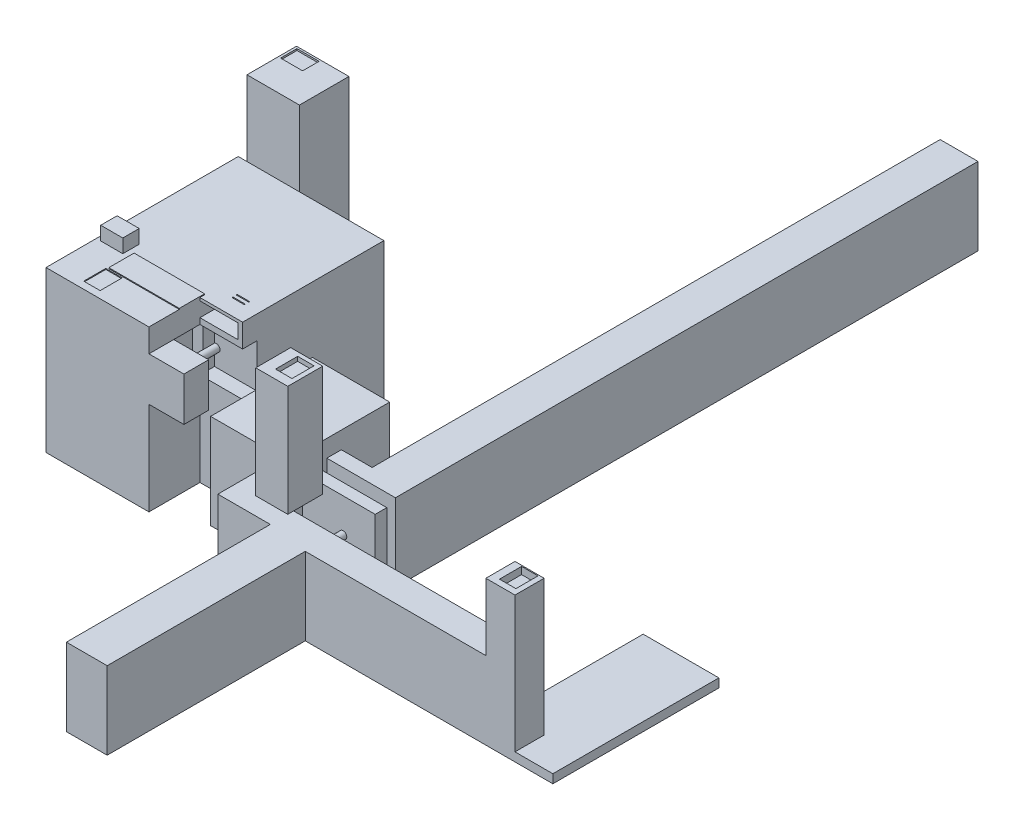
from build123d import *

# Parameters (mm, degrees)
SKETCH1_W            = 500
SKETCH1_H            = 500
BOSS_EXTRUDE1_DEPTH  = 550
SKETCH2_W            = 75.8
SKETCH2_H            = 56.4
BOSS_EXTRUDE2_DEPTH  = 46.8
SKETCH5_W            = 31
SKETCH5_H            = 3.15
BOSS_EXTRUDE4_DEPTH  = 242
SKETCH6_W            = 146.6
SKETCH6_H            = 15
CUT_EXTRUDE2_DEPTH   = 654.834841531
SKETCH7_W            = 353.4
SKETCH7_H            = 550
BOSS_EXTRUDE5_DEPTH  = 160
SKETCH8_W            = 242
SKETCH8_H            = 3.15
BOSS_EXTRUDE6_DEPTH  = 55.8
SKETCH9_W            = 56.4
SKETCH9_H            = 75.8
CUT_EXTRUDE3_DEPTH   = 3.25
CUT_EXTRUDE6_DEPTH   = 10
SKETCH13_W           = 130
SKETCH13_H           = 50
CUT_EXTRUDE7_DEPTH   = 130
LPATTERN1_COUNT      = 2
LPATTERN1_PITCH      = 15
SKETCH14_W           = 146.6
SKETCH14_H           = 150
CUT_EXTRUDE8_DEPTH   = 50
SKETCH15_W           = 350
SKETCH15_H           = 325
BOSS_EXTRUDE7_DEPTH  = 265
SKETCH16_W           = 50
SKETCH16_H           = 266.2
BOSS_EXTRUDE8_DEPTH  = 235.5
SKETCH17_W           = 130
SKETCH17_H           = 266.2
BOSS_EXTRUDE9_DEPTH  = 1950
SKETCH18_W           = 80
SKETCH18_H           = 266.2
BOSS_EXTRUDE10_DEPTH = 160
SKETCH19_W           = 780
SKETCH19_H           = 266.2
BOSS_EXTRUDE11_DEPTH = 240
SKETCH20_W           = 700
SKETCH20_H           = 266.2
CUT_EXTRUDE9_DEPTH   = 100
SKETCH21_W           = 100
SKETCH21_H           = 266.2
BOSS_EXTRUDE12_DEPTH = 720
SKETCH22_W           = 100
SKETCH22_H           = 100
BOSS_EXTRUDE14_DEPTH = 230
SKETCH23_W           = 56.4
SKETCH23_H           = 75.8
CUT_EXTRUDE10_DEPTH  = 24.4
SKETCH24_W           = 40
SKETCH24_H           = 266.2
BOSS_EXTRUDE15_DEPTH = 250
BOSS_EXTRUDE16_REACH = 2623.994
SKETCH25_R           = 12.5
SKETCH26_W           = 110
SKETCH26_H           = 120
BOSS_EXTRUDE22_DEPTH = 365.6
SKETCH28_W           = 110
SKETCH28_H           = 120
SKETCH28_W_2         = 56.4
SKETCH28_H_2         = 75.8
BOSS_EXTRUDE23_DEPTH = 15
SKETCH29_W           = 100
SKETCH29_H           = 150
CUT_EXTRUDE11_DEPTH  = 35
SKETCH30_W           = 85
SKETCH30_H           = 150
BOSS_EXTRUDE24_DEPTH = 120
BOSS_EXTRUDE25_REACH = 2659.625
SKETCH31_R           = 12.5
SKETCH32_W           = 220
SKETCH32_H           = 550
BOSS_EXTRUDE26_DEPTH = 30
SKETCH34_W           = 180
SKETCH34_H           = 808
BOSS_EXTRUDE28_DEPTH = 170
SKETCH35_W           = 75.8
SKETCH35_H           = 56.4
CUT_EXTRUDE12_DEPTH  = 5.8
BOSS_EXTRUDE29_DEPTH = 30


with BuildPart() as part:
    # Sketch1 → Boss-Extrude1 (new body)
    with BuildSketch(Plane(origin=(0, 0, 0), x_dir=(1, 0, 0), z_dir=(0, 1, 0))):
        Rectangle(SKETCH1_W, SKETCH1_H)
    extrude(amount=BOSS_EXTRUDE1_DEPTH)

    # Sketch2 → Boss-Extrude2 (add)
    with BuildSketch(Plane(origin=(0, 550, 0), x_dir=(1, 0, 0), z_dir=(0, 1, 0))):
        with Locations((-197.1, -209)):
            Rectangle(SKETCH2_W, SKETCH2_H)
    extrude(amount=BOSS_EXTRUDE2_DEPTH)

    # Sketch5 → Boss-Extrude4 (add)
    with BuildSketch(Plane(origin=(-138.6, 0, 0), x_dir=(0, 0, -1), z_dir=(1, 0, 0))):
        with Locations((-234.5, 551.575)):
            Rectangle(SKETCH5_W, SKETCH5_H)
    extrude(amount=BOSS_EXTRUDE4_DEPTH)

    # Sketch6 → Cut-Extrude2 (cut, through all)
    with BuildSketch(Plane(origin=(0, 550, 0), x_dir=(1, 0, 0), z_dir=(0, 1, 0))):
        with Locations((176.7, -242.5)):
            Rectangle(SKETCH6_W, SKETCH6_H)
    extrude(amount=-CUT_EXTRUDE2_DEPTH, mode=Mode.SUBTRACT)

    # Sketch7 → Boss-Extrude5 (add)
    with BuildSketch(Plane.XY.offset(250)):
        with Locations((-73.3, 275)):
            Rectangle(SKETCH7_W, SKETCH7_H)
    extrude(amount=BOSS_EXTRUDE5_DEPTH)

    # Sketch8 → Boss-Extrude6 (add)
    with BuildSketch(Plane.XY.offset(250)):
        with Locations((-17.6, 551.575)):
            Rectangle(SKETCH8_W, SKETCH8_H)
    extrude(amount=BOSS_EXTRUDE6_DEPTH)

    # Sketch9 → Cut-Extrude3 (cut)
    with BuildSketch(Plane(origin=(0, 550, 0), x_dir=(1, 0, 0), z_dir=(0, 1, 0))):
        with Locations((-116.6, -347.9)):
            Rectangle(SKETCH9_W, SKETCH9_H)
    extrude(amount=-CUT_EXTRUDE3_DEPTH, mode=Mode.SUBTRACT)

    # Sketch12 → Cut-Extrude6 (cut)
    with BuildSketch(Plane(origin=(0, 550, 0), x_dir=(1, 0, 0), z_dir=(0, 1, 0))):
        with BuildLine():
            Line((200, -176.7), (160, -176.7))
            ThreePointArc((160, -176.7), (158.3, -178.4), (160, -180.1))
            Line((160, -180.1), (200, -180.1))
            ThreePointArc((200, -180.1), (201.7, -178.4), (200, -176.7))
        make_face()
    cut_extrude6 = extrude(amount=-CUT_EXTRUDE6_DEPTH, mode=Mode.SUBTRACT)

    # Sketch13 → Cut-Extrude7 (cut)
    with BuildSketch(Plane.XY.offset(235)):
        with Locations((168.4, 515)):
            Rectangle(SKETCH13_W, SKETCH13_H)
    extrude(amount=-CUT_EXTRUDE7_DEPTH, mode=Mode.SUBTRACT)

    # LPattern1: Cut-Extrude6 ×2
    with Locations(*[(0, 0, -i * LPATTERN1_PITCH) for i in range(1, LPATTERN1_COUNT)]):
        add(cut_extrude6, mode=Mode.SUBTRACT)

    # Sketch14 → Cut-Extrude8 (cut)
    with BuildSketch(Plane.XY.offset(235)):
        with Locations((176.7, 395)):
            Rectangle(SKETCH14_W, SKETCH14_H)
    extrude(amount=-CUT_EXTRUDE8_DEPTH, mode=Mode.SUBTRACT)

    # Sketch15 → Boss-Extrude7 (add)
    with BuildSketch(Plane(origin=(250, 0, 0), x_dir=(0, 0, -1), z_dir=(1, 0, 0))):
        with Locations((-170, 162.5)):
            Rectangle(SKETCH15_W, SKETCH15_H)
    extrude(amount=BOSS_EXTRUDE7_DEPTH)

    # Sketch16 → Boss-Extrude8 (add)
    with BuildSketch(Plane(origin=(515, 0, 0), x_dir=(0, 0, -1), z_dir=(1, 0, 0))):
        with Locations((-186, 133.1)):
            Rectangle(SKETCH16_W, SKETCH16_H)
    extrude(amount=BOSS_EXTRUDE8_DEPTH)

    # Sketch17 → Boss-Extrude9 (add)
    with BuildSketch(Plane(origin=(0, 0, 161), x_dir=(-1, 0, 0), z_dir=(0, 0, -1))):
        with Locations((-685.5, 133.1)):
            Rectangle(SKETCH17_W, SKETCH17_H)
    extrude(amount=BOSS_EXTRUDE9_DEPTH)

    # Sketch18 → Boss-Extrude10 (add)
    with BuildSketch(Plane.XY.offset(345)):
        with Locations((475, 133.1)):
            Rectangle(SKETCH18_W, SKETCH18_H)
    extrude(amount=BOSS_EXTRUDE10_DEPTH)

    # Sketch19 → Boss-Extrude11 (add)
    with BuildSketch(Plane(origin=(515, 0, 0), x_dir=(0, 0, -1), z_dir=(1, 0, 0))):
        with Locations((-815, 133.1)):
            Rectangle(SKETCH19_W, SKETCH19_H)
    extrude(amount=BOSS_EXTRUDE11_DEPTH)

    # Sketch20 → Cut-Extrude9 (cut)
    with BuildSketch(Plane.ZY.offset(-515)):
        with Locations((855, 133.1)):
            Rectangle(SKETCH20_W, SKETCH20_H)
    extrude(amount=-CUT_EXTRUDE9_DEPTH, mode=Mode.SUBTRACT)

    # Sketch21 → Boss-Extrude12 (add)
    with BuildSketch(Plane(origin=(755, 0, 0), x_dir=(0, 0, -1), z_dir=(1, 0, 0))):
        with Locations((-475, 133.1)):
            Rectangle(SKETCH21_W, SKETCH21_H)
    extrude(amount=BOSS_EXTRUDE12_DEPTH)

    # Sketch22 → Boss-Extrude14 (add)
    with BuildSketch(Plane(origin=(0, 266.2, 0), x_dir=(1, 0, 0), z_dir=(0, 1, 0))):
        with Locations((1425, -475)):
            Rectangle(SKETCH22_W, SKETCH22_H)
    extrude(amount=BOSS_EXTRUDE14_DEPTH)

    # Sketch23 → Cut-Extrude10 (cut)
    with BuildSketch(Plane(origin=(0, 496.2, 0), x_dir=(1, 0, 0), z_dir=(0, 1, 0))):
        with Locations((1429.3, -466.45)):
            Rectangle(SKETCH23_W, SKETCH23_H)
    extrude(amount=-CUT_EXTRUDE10_DEPTH, mode=Mode.SUBTRACT)

    # Sketch24 → Boss-Extrude15 (add)
    with BuildSketch(Plane(origin=(515, 0, 0), x_dir=(0, 0, -1), z_dir=(1, 0, 0))):
        with Locations((-275, 133.1)):
            Rectangle(SKETCH24_W, SKETCH24_H)
    extrude(amount=BOSS_EXTRUDE15_DEPTH)

    # Sketch25 → Boss-Extrude16 (add, up to next)
    with BuildSketch(Plane.XY.offset(295), mode=Mode.PRIVATE) as boss_extrude16_sk1:
        with Locations(Location((655, 150, 0), (0, 0, 180))):
            Circle(SKETCH25_R)
    boss_extrude16_tool1 = extrude(boss_extrude16_sk1.sketch, amount=BOSS_EXTRUDE16_REACH, mode=Mode.PRIVATE) - part.part
    add(boss_extrude16_tool1.solids().sort_by_distance((655, 150, 295))[0])

    # Sketch26 → Boss-Extrude22 (add)
    with BuildSketch(Plane(origin=(0, 266.2, 0), x_dir=(1, 0, 0), z_dir=(0, 1, 0))):
        with Locations((560, -385)):
            Rectangle(SKETCH26_W, SKETCH26_H)
    extrude(amount=BOSS_EXTRUDE22_DEPTH)

    # Sketch28 → Boss-Extrude23 (add)
    with BuildSketch(Plane(origin=(0, 631.8, 0), x_dir=(1, 0, 0), z_dir=(0, 1, 0))):
        with Locations((560, -385)):
            Rectangle(SKETCH28_W, SKETCH28_H)
        with Locations((570.98, -376.8)):
            Rectangle(SKETCH28_W_2, SKETCH28_H_2, mode=Mode.SUBTRACT)
    extrude(amount=BOSS_EXTRUDE23_DEPTH)

    # Sketch29 → Cut-Extrude11 (cut)
    with BuildSketch(Plane(origin=(103.4, 0, 0), x_dir=(0, 0, -1), z_dir=(1, 0, 0))):
        with Locations((-275, 395)):
            Rectangle(SKETCH29_W, SKETCH29_H)
    extrude(amount=-CUT_EXTRUDE11_DEPTH, mode=Mode.SUBTRACT)

    # Sketch30 → Boss-Extrude24 (add)
    with BuildSketch(Plane(origin=(103.4, 0, 0), x_dir=(0, 0, -1), z_dir=(1, 0, 0))):
        with Locations((-367.5, 395)):
            Rectangle(SKETCH30_W, SKETCH30_H)
    extrude(amount=BOSS_EXTRUDE24_DEPTH)

    # Sketch31 → Boss-Extrude25 (add, up to next)
    with BuildSketch(Plane(origin=(0, 0, 325), x_dir=(-1, 0, 0), z_dir=(0, 0, -1)), mode=Mode.PRIVATE) as boss_extrude25_sk1:
        with Locations(Location((-109.9, 378.75, 0), (0, 0, 180))):
            Circle(SKETCH31_R)
    boss_extrude25_tool1 = extrude(boss_extrude25_sk1.sketch, amount=BOSS_EXTRUDE25_REACH, mode=Mode.PRIVATE) - part.part
    add(boss_extrude25_tool1.solids().sort_by_distance((109.9, 378.75, 325))[0])

    # Sketch32 → Boss-Extrude26 (add)
    with BuildSketch(Plane.XZ):
        with Locations((1475, 250)):
            Rectangle(SKETCH32_W, SKETCH32_H)
    extrude(amount=-BOSS_EXTRUDE26_DEPTH)

    # Sketch34 → Boss-Extrude28 (add)
    with BuildSketch(Plane(origin=(0, 0, -250), x_dir=(-1, 0, 0), z_dir=(0, 0, -1))):
        with Locations((130, 404)):
            Rectangle(SKETCH34_W, SKETCH34_H)
    extrude(amount=BOSS_EXTRUDE28_DEPTH)

    # Sketch35 → Cut-Extrude12 (cut)
    with BuildSketch(Plane(origin=(0, 808, 0), x_dir=(1, 0, 0), z_dir=(0, 1, 0))):
        with Locations((-174.2, 385.4)):
            Rectangle(SKETCH35_W, SKETCH35_H)
    extrude(amount=-CUT_EXTRUDE12_DEPTH, mode=Mode.SUBTRACT)

    # Sketch36 → Boss-Extrude29 (add)
    with BuildSketch(Plane(origin=(0, 30, 0), x_dir=(1, 0, 0), z_dir=(0, 1, 0))):
        Polygon((1365, -425), (1365, 25), (1585, 25), (1585, -525), (1605, -525), (1605, 45), (1345, 45), (1345, -425), align=None)
    extrude(amount=-BOSS_EXTRUDE29_DEPTH)


solid = part.part
